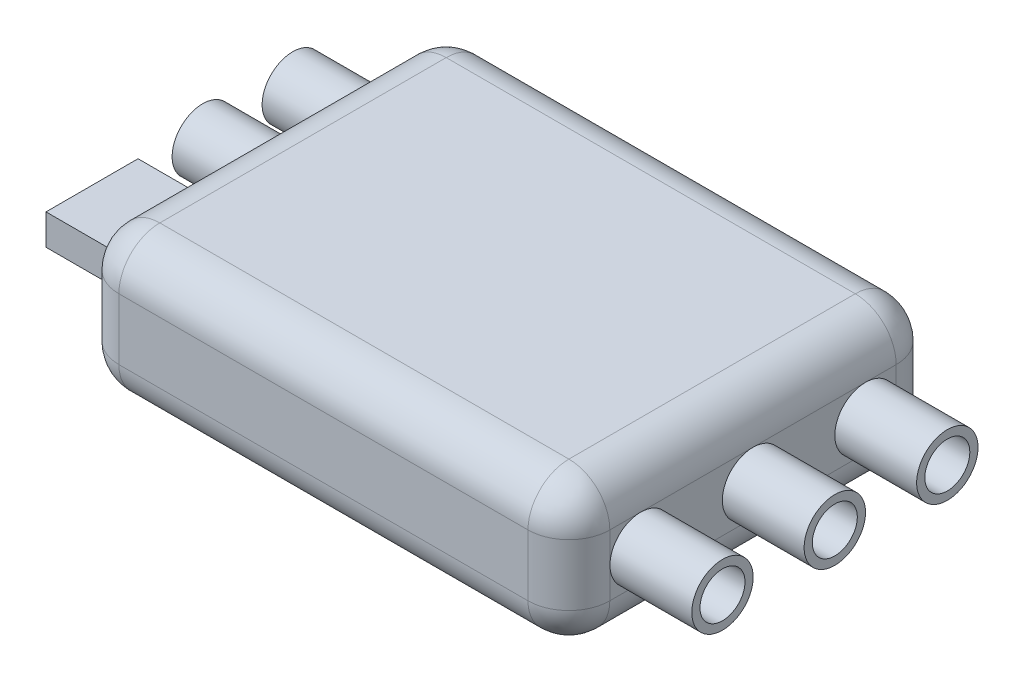
from build123d import *

# Parameters (mm, degrees)
BOSS_EXTRUDE1_DEPTH = 7
FILLET1_R           = 2
SKETCH2_R           = 1.5
SKETCH2_R_2         = 1.1
BOSS_EXTRUDE2_DEPTH = 4
BOSS_EXTRUDE3_START = 4
SKETCH3_R           = 1.5
SKETCH3_R_2         = 1.1
SKETCH3_W           = 4.5
SKETCH3_H           = 1.5
BOSS_EXTRUDE3_DEPTH = 4


with BuildPart() as part:
    # Sketch1 → Boss-Extrude1 (new body)
    with BuildSketch(Plane(origin=(0, 0, 0), x_dir=(1, 0, 0), z_dir=(0, 1, 0))):
        with BuildLine():
            Line((-10, -9), (10, -9))
            ThreePointArc((10, -9), (11.414213562, -8.414213562), (12, -7))
            Line((12, -7), (12, 7))
            ThreePointArc((12, 7), (11.414213562, 8.414213562), (10, 9))
            Line((10, 9), (-10, 9))
            ThreePointArc((-10, 9), (-11.414213562, 8.414213562), (-12, 7))
            Line((-12, 7), (-12, -7))
            ThreePointArc((-12, -7), (-11.414213562, -8.414213562), (-10, -9))
        make_face()
    extrude(amount=BOSS_EXTRUDE1_DEPTH)

    # Fillet1
    fillet1_edges = [part.edges().sort_by_distance(p)[0] for p in [
        (0, 0, -9),
        (11.414213562, 0, -8.414213562),
        (12, 0, 0),
        (11.414213562, 0, 8.414213562),
        (11.414213562, 7, -8.414213562),
        (0, 7, -9),
        (-11.414213562, 7, -8.414213562),
        (-12, 7, 0),
        (-11.414213562, 7, 8.414213562),
        (0, 7, 9),
        (11.414213562, 7, 8.414213562),
        (0, 0, 9),
        (12, 7, 0),
        (-11.414213562, 0, 8.414213562),
        (-12, 0, 0),
        (-11.414213562, 0, -8.414213562),
    ]]
    fillet(fillet1_edges, radius=FILLET1_R)

    # Sketch2 → Boss-Extrude2 (add)
    # profile 1 of 3: a face of its own
    with BuildSketch(Plane(origin=(12, 0, 0), x_dir=(0, 0, -1), z_dir=(1, 0, 0))):
        with Locations(Location((0, 3.5, 0), (0, 0, 270))):
            Circle(SKETCH2_R)
        with Locations((0, 3.5)):
            Circle(SKETCH2_R_2, mode=Mode.SUBTRACT)
    # profile 2 of 3: a face of its own
    with BuildSketch(Plane(origin=(12, 0, 0), x_dir=(0, 0, -1), z_dir=(1, 0, 0))):
        with Locations((5.5, 3.5)):
            Circle(SKETCH2_R)
        with Locations((5.5, 3.5)):
            Circle(SKETCH2_R_2, mode=Mode.SUBTRACT)
    # profile 3 of 3: a face of its own
    with BuildSketch(Plane(origin=(12, 0, 0), x_dir=(0, 0, -1), z_dir=(1, 0, 0))):
        with Locations(Location((-5.491961295, 3.5, 0), (0, 0, 270))):
            Circle(SKETCH2_R)
        with Locations((-5.491961295, 3.5)):
            Circle(SKETCH2_R_2, mode=Mode.SUBTRACT)
    extrude(amount=BOSS_EXTRUDE2_DEPTH)

    # Sketch3 → Boss-Extrude3 (add)
    # profile 1 of 3: a face of its own
    with BuildSketch(Plane.ZY.offset(12).offset(BOSS_EXTRUDE3_START)):
        with Locations(Location((-5.5, 3.5, 0), (0, 0, 180))):
            Circle(SKETCH3_R)
        with Locations(Location((-5.5, 3.5, 0), (0, 0, 180))):
            Circle(SKETCH3_R_2, mode=Mode.SUBTRACT)
    # profile 2 of 3: a face of its own
    with BuildSketch(Plane.ZY.offset(12).offset(BOSS_EXTRUDE3_START)):
        with Locations(Location((-1.1, 3.5, 0), (0, 0, 270))):
            Circle(SKETCH3_R)
        with Locations((-1.1, 3.5)):
            Circle(SKETCH3_R_2, mode=Mode.SUBTRACT)
    # profile 3 of 3: a face of its own
    with BuildSketch(Plane.ZY.offset(12).offset(BOSS_EXTRUDE3_START)):
        with Locations((4.314762853, 3.5)):
            Rectangle(SKETCH3_W, SKETCH3_H)
    extrude(amount=-BOSS_EXTRUDE3_DEPTH)


solid = part.part
